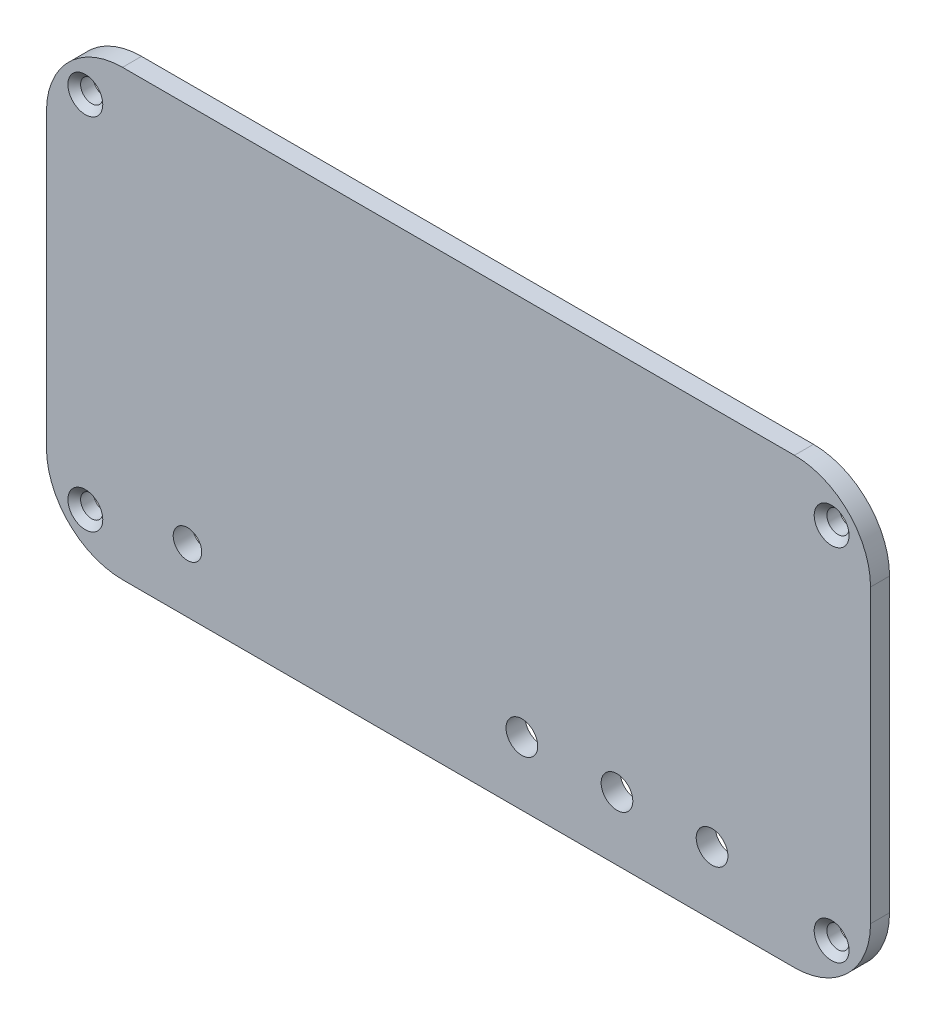
from build123d import *

# Parameters (mm, degrees)
SKETCH_2_R               = 2.5
SKETCH_2_R_2             = 2.25
EXTRUDE_1_DEPTH          = 3
SKETCH_3_W               = 6
SKETCH_3_H               = 8
EXTRUDE_2_DEPTH          = 3.4
SKETCH_4_R               = 1.25
CUT_EXTRUDE_1_DEPTH      = 5
CUT_EXTRUDE_2_DEPTH      = 75.101012139
CUT_EXTRUDE_2_DEPTH_BACK = 3
SKETCH_5_R               = 1.75
CHAMFER_1_SIZE           = 1


with BuildPart() as part:
    # Эскиз2 → Бобышка-Вытянуть1 (new body)
    with BuildSketch(Plane.XY):
        with BuildLine():
            Line((-53, 35), (53, 35))
            ThreePointArc((53, 35), (61.485281374, 31.485281374), (65, 23))
            Line((65, 23), (65, -23))
            ThreePointArc((65, -23), (61.485281374, -31.485281374), (53, -35))
            Line((53, -35), (-53, -35))
            ThreePointArc((-53, -35), (-61.485281374, -31.485281374), (-65, -23))
            Line((-65, -23), (-65, 23))
            ThreePointArc((-65, 23), (-61.485281374, 31.485281374), (-53, 35))
        make_face()
        with Locations((10, -25)):
            Circle(SKETCH_2_R, mode=Mode.SUBTRACT)
        with Locations((25, -25)):
            Circle(SKETCH_2_R, mode=Mode.SUBTRACT)
        with Locations((40, -25)):
            Circle(SKETCH_2_R, mode=Mode.SUBTRACT)
        with Locations((-42.754119413, -25)):
            Circle(SKETCH_2_R_2, mode=Mode.SUBTRACT)
    extrude(amount=EXTRUDE_1_DEPTH)

    # Эскиз3 → Бобышка-Вытянуть2 (add)
    with BuildSketch(Plane(origin=(0, 0, 0), x_dir=(-1, 0, 0), z_dir=(0, 0, -1))):
        with Locations((0, -25)):
            Rectangle(SKETCH_3_W, SKETCH_3_H)
        with Locations((-50, -25)):
            Rectangle(SKETCH_3_W, SKETCH_3_H)
    extrude(amount=EXTRUDE_2_DEPTH)

    # Эскиз4 → Вырез-Вытянуть1 (cut)
    with BuildSketch(Plane(origin=(0, 0, -3.4), x_dir=(-1, 0, 0), z_dir=(0, 0, -1))):
        with Locations((-50, -25)):
            Circle(SKETCH_4_R)
        with Locations(Location((0, -25, 0), (0, 0, 180))):
            Circle(SKETCH_4_R)
    extrude(amount=-CUT_EXTRUDE_1_DEPTH, mode=Mode.SUBTRACT)

    # Эскиз5 → Вырез-Вытянуть2 (cut, two sides: drawn at the far end of the back side and taken through both)
    with BuildSketch(Plane.XY.offset(3).offset(-CUT_EXTRUDE_2_DEPTH_BACK)):
        with Locations(Location((-58.865243762, 28.354943792, 0), (0, 0, 180))):
            Circle(SKETCH_5_R)
        with Locations(Location((-58.865243762, -28.354943792, 0), (0, 0, 180))):
            Circle(SKETCH_5_R)
        with Locations(Location((58.865243762, 28.354943792, 0), (0, 0, 180))):
            Circle(SKETCH_5_R)
        with Locations(Location((58.865243762, -28.354943792, 0), (0, 0, 180))):
            Circle(SKETCH_5_R)
    extrude(amount=CUT_EXTRUDE_2_DEPTH + CUT_EXTRUDE_2_DEPTH_BACK, mode=Mode.SUBTRACT)

    # Фаска1
    chamfer_1_edges = [part.edges().sort_by_distance(p)[0] for p in [
        (-57.115243762, -28.354943792, 3),
        (60.615243762, 28.354943792, 3),
        (60.615243762, -28.354943792, 3),
        (-57.115243762, 28.354943792, 3),
    ]]
    chamfer(chamfer_1_edges, length=CHAMFER_1_SIZE)


solid = part.part
